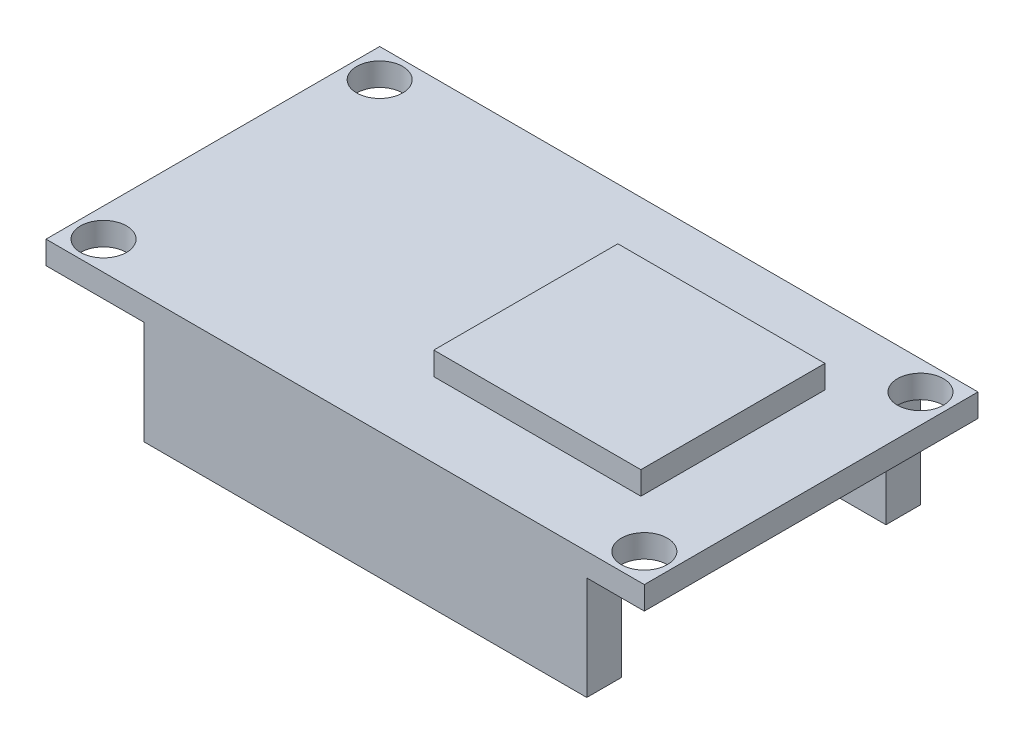
from build123d import *

# Parameters (mm, degrees)
SKETCH_1_W      = 52
SKETCH_1_H      = 29
SKETCH_1_R      = 2
EXTRUDE_1_DEPTH = 2
SKETCH_2_W      = 18
SKETCH_2_H      = 16
EXTRUDE_2_DEPTH = 2
SKETCH_3_W      = 38.5
SKETCH_3_H      = 3
EXTRUDE_3_DEPTH = 9


with BuildPart() as part:
    # 草图1 → 凸台-拉伸1 (new body)
    with BuildSketch(Plane(origin=(0, 0, 0), x_dir=(1, 0, 0), z_dir=(0, 1, 0))):
        with Locations((26, 14.5)):
            Rectangle(SKETCH_1_W, SKETCH_1_H)
        with Locations(Location((49.5, 26.5, 0), (0, 0, 270))):
            Circle(SKETCH_1_R, mode=Mode.SUBTRACT)
        with Locations(Location((49.5, 2.5, 0), (0, 0, 90))):
            Circle(SKETCH_1_R, mode=Mode.SUBTRACT)
        with Locations(Location((2.5, 2.5, 0), (0, 0, 270))):
            Circle(SKETCH_1_R, mode=Mode.SUBTRACT)
        with Locations(Location((2.5, 26.5, 0), (0, 0, 90))):
            Circle(SKETCH_1_R, mode=Mode.SUBTRACT)
    extrude(amount=EXTRUDE_1_DEPTH)

    # 草图2 → 凸台-拉伸2 (add)
    with BuildSketch(Plane(origin=(0, 2, 0), x_dir=(1, 0, 0), z_dir=(0, 1, 0))):
        with Locations((36.2, 14.5)):
            Rectangle(SKETCH_2_W, SKETCH_2_H)
    extrude(amount=EXTRUDE_2_DEPTH)

    # 草图3 → 凸台-拉伸3 (add)
    with BuildSketch(Plane.XZ):
        with Locations((27.75, -1.5)):
            Rectangle(SKETCH_3_W, SKETCH_3_H)
        with Locations((27.75, -27.5)):
            Rectangle(SKETCH_3_W, SKETCH_3_H)
    extrude(amount=EXTRUDE_3_DEPTH)


solid = part.part
